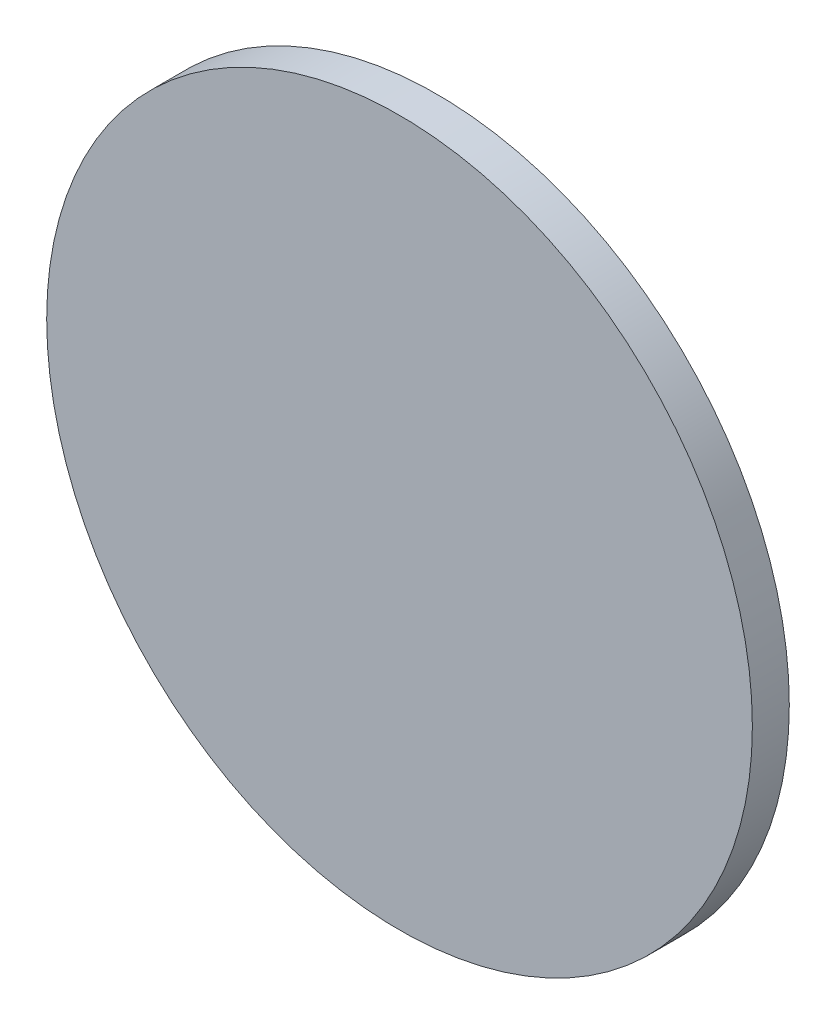
from build123d import *

# Parameters (mm, degrees)
ESQUISSE1_R        = 47.75
BOSS_EXTRU_1_DEPTH = 5


with BuildPart() as part:
    # Esquisse1 → Boss.-Extru.1 (new body)
    with BuildSketch(Plane.XY):
        Circle(ESQUISSE1_R)
    extrude(amount=BOSS_EXTRU_1_DEPTH)


solid = part.part
